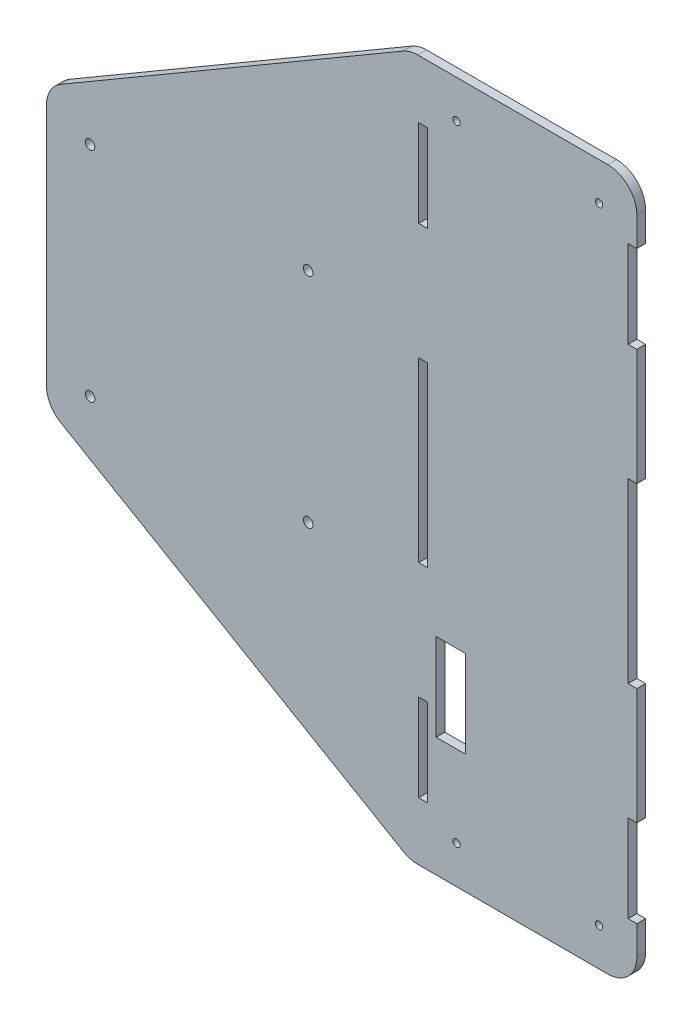
from build123d import *

# Parameters (mm, degrees)
SKETCH_1_W          = 78
SKETCH_1_H          = 241
EXTRUDE_1_DEPTH     = 3
EXTRUDE_2_DEPTH     = 3
SKETCH_5_W          = 3
SKETCH_5_H          = 30
SKETCH_5_H_2        = 61
CUT_EXTRUDE_3_DEPTH = 3
SKETCH_6_W          = 3
SKETCH_6_H          = 30
SKETCH_6_H_2        = 61
CUT_EXTRUDE_4_DEPTH = 3
SKETCH_7_W          = 10
SKETCH_7_H          = 30
CUT_EXTRUDE_5_DEPTH = 3
FILLET_1_R          = 10
HOLE_WIZARD_M4_1_D  = 3.3
HOLE_WIZARD_M3_2_D  = 2.5


with BuildPart() as part:
    # 草图1 → 凸台-拉伸1 (new body)
    with BuildSketch(Plane.XY):
        with Locations((37.174772521, -24.067785913)):
            Rectangle(SKETCH_1_W, SKETCH_1_H)
    extrude(amount=-EXTRUDE_1_DEPTH)

    # 草图2 → 凸台-拉伸2 (add)
    with BuildSketch(Plane.XY):
        Polygon((-1.825227479, 96.432214087), (-126.825227479, 23.432214087), (-126.825227479, -71.567785913), (-1.825227479, -144.567785913), align=None)
    extrude(amount=-EXTRUDE_2_DEPTH)

    # 草图5 → 切除-拉伸3 (cut)
    with BuildSketch(Plane.XY):
        with Locations((74.674772521, 61.432214087)):
            Rectangle(SKETCH_5_W, SKETCH_5_H)
        with Locations((74.674772521, -109.567785913)):
            Rectangle(SKETCH_5_W, SKETCH_5_H)
        with Locations((74.674772521, -24.067785913)):
            Rectangle(SKETCH_5_W, SKETCH_5_H_2)
    extrude(amount=-CUT_EXTRUDE_3_DEPTH, mode=Mode.SUBTRACT)

    # 草图6 → 切除-拉伸4 (cut)
    with BuildSketch(Plane(origin=(0, 0, -3), x_dir=(-1, 0, 0), z_dir=(0, 0, -1))):
        with Locations((-2.674772521, 61.432214087)):
            Rectangle(SKETCH_6_W, SKETCH_6_H)
        with Locations((-2.674772521, -24.067785913)):
            Rectangle(SKETCH_6_W, SKETCH_6_H_2)
        with Locations((-2.674772521, -109.567785913)):
            Rectangle(SKETCH_6_W, SKETCH_6_H)
    extrude(amount=-CUT_EXTRUDE_4_DEPTH, mode=Mode.SUBTRACT)

    # 草图7 → 切除-拉伸5 (cut)
    with BuildSketch(Plane.XY):
        with Locations((12.174772521, -88.567785913)):
            Rectangle(SKETCH_7_W, SKETCH_7_H)
    extrude(amount=-CUT_EXTRUDE_5_DEPTH, mode=Mode.SUBTRACT)

    # 圆角1
    fillet_1_edges = [part.edges().sort_by_distance(p)[0] for p in [
        (-126.825227479, -71.567785913, -1.5),
        (-126.825227479, 23.432214087, -1.5),
        (-1.825227479, 96.432214087, -1.5),
        (-1.825227479, -144.567785913, -1.5),
        (76.174772521, -144.567785913, -1.5),
        (76.174772521, 96.432214087, -1.5),
    ]]
    fillet(fillet_1_edges, radius=FILLET_1_R)

    # M4 螺纹孔的螺纹孔钻头1 (through all)
    with Locations(Plane(origin=(-111.825227479, 13.432214087, -3), x_dir=(-1, 0, 0), z_dir=(0, 0, -1))):
        with Locations((0, 0), (0, -75), (-75, -75), (-75, 0)):
            Hole(HOLE_WIZARD_M4_1_D / 2)

    # M3 螺纹孔的螺纹孔钻头2 (through all)
    with Locations(Plane(origin=(63.174772521, -131.567785913, -3), x_dir=(-1, 0, 0), z_dir=(0, 0, -1))):
        with Locations((0, 0), (49, 0), (0, 215), (49, 215)):
            Hole(HOLE_WIZARD_M3_2_D / 2)


solid = part.part
